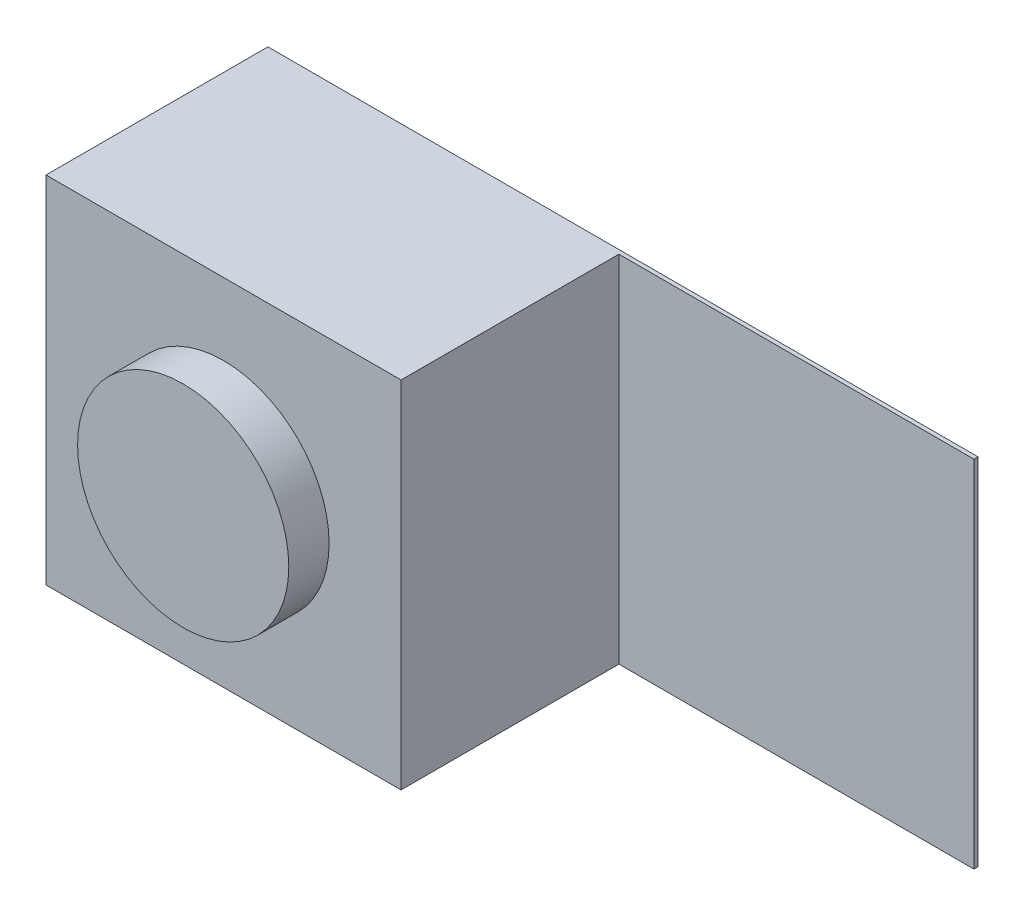
from build123d import *

# Parameters (mm, degrees)
SKETCH1_W           = 8.8
SKETCH1_H           = 8.8
BOSS_EXTRUDE1_DEPTH = 5.5
SKETCH2_W           = 17.6
SKETCH2_H           = 8.8
BOSS_EXTRUDE2_DEPTH = 0.1
SKETCH3_R           = 2.617377511
BOSS_EXTRUDE3_DEPTH = 1


with BuildPart() as part:
    # Sketch1 → Boss-Extrude1 (new body)
    with BuildSketch(Plane.XY):
        Rectangle(SKETCH1_W, SKETCH1_H)
    extrude(amount=BOSS_EXTRUDE1_DEPTH)

    # Sketch2 → Boss-Extrude2 (add)
    with BuildSketch(Plane(origin=(0, 0, 0), x_dir=(-1, 0, 0), z_dir=(0, 0, -1))):
        with Locations((-4.4, 0)):
            Rectangle(SKETCH2_W, SKETCH2_H)
    extrude(amount=-BOSS_EXTRUDE2_DEPTH)

    # Sketch3 → Boss-Extrude3 (add)
    with BuildSketch(Plane.XY.offset(5.5)):
        Circle(SKETCH3_R)
    extrude(amount=BOSS_EXTRUDE3_DEPTH)


solid = part.part
